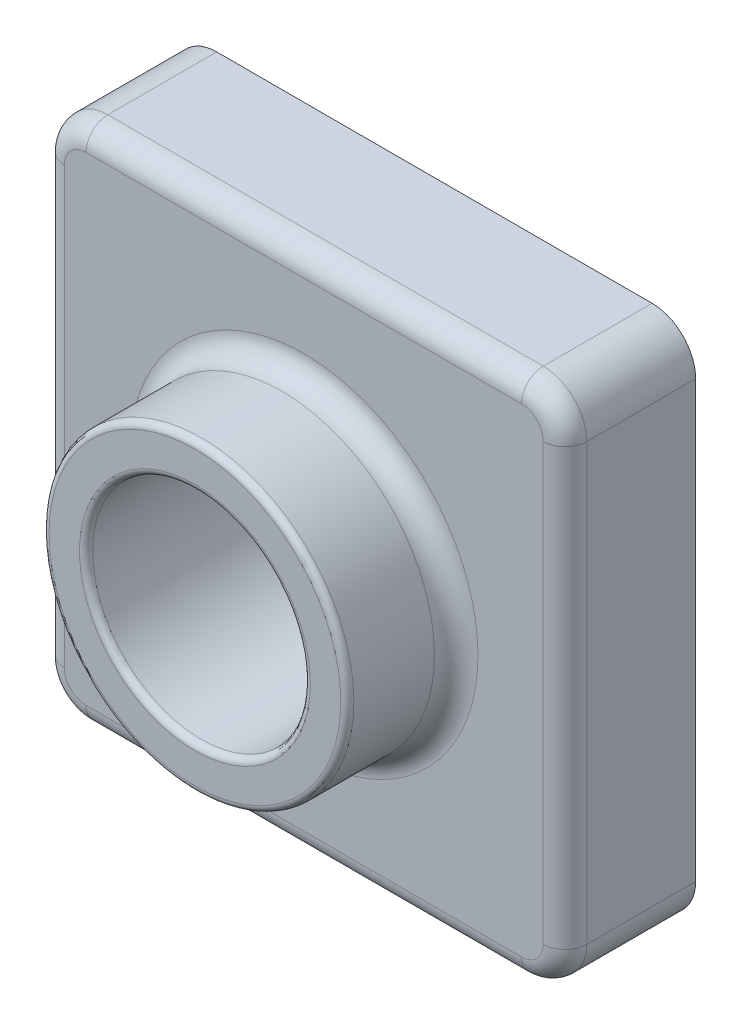
from build123d import *

# Parameters (mm, degrees)
SKETCH3_W           = 120
SKETCH3_H           = 120
BOSS_EXTRUDE1_DEPTH = 30
SKETCH4_R           = 35
BOSS_EXTRUDE2_DEPTH = 25
SKETCH5_R           = 25
CUT_EXTRUDE1_DEPTH  = 102.118742081
FILLET2_R           = 1.5
FILLET3_R           = 10
SHELL1_T            = -2
FILLET4_R           = 5


with BuildPart() as part:
    # Sketch3 → Boss-Extrude1 (new body)
    with BuildSketch(Plane.XY):
        Rectangle(SKETCH3_W, SKETCH3_H)
    extrude(amount=BOSS_EXTRUDE1_DEPTH)

    # Sketch4 → Boss-Extrude2 (add)
    with BuildSketch(Plane.XY.offset(30)):
        Circle(SKETCH4_R)
    extrude(amount=BOSS_EXTRUDE2_DEPTH)

    # Sketch5 → Cut-Extrude1 (cut, through all)
    with BuildSketch(Plane.XY.offset(55)):
        Circle(SKETCH5_R)
    extrude(amount=-CUT_EXTRUDE1_DEPTH, mode=Mode.SUBTRACT)

    # Fillet2
    fillet2_edges = [part.edges().sort_by_distance(p)[0] for p in [
        (-35, 0, 55),
        (-25, 0, 55),
    ]]
    fillet(fillet2_edges, radius=FILLET2_R)

    # Fillet3
    fillet3_edges = [part.edges().sort_by_distance(p)[0] for p in [
        (-60, -60, 15),
        (60, -60, 15),
        (60, 60, 15),
        (-60, 60, 15),
    ]]
    fillet(fillet3_edges, radius=FILLET3_R)

    # Shell1
    shell1_openings = [part.faces().sort_by_distance(p)[0] for p in [
        (0, -58.302943725, 0),
    ]]
    offset(amount=SHELL1_T, openings=shell1_openings, kind=Kind.INTERSECTION)

    # Fillet4
    fillet4_edges = [part.edges().sort_by_distance(p)[0] for p in [
        (-35, 0, 30),
        (-60, 0, 30),
        (0, 60, 30),
        (0, -60, 30),
        (60, 0, 30),
        (57.071067812, 57.071067812, 30),
        (57.071067812, -57.071067812, 30),
        (-57.071067812, -57.071067812, 30),
        (-57.071067812, 57.071067812, 30),
    ]]
    fillet(fillet4_edges, radius=FILLET4_R)


solid = part.part
